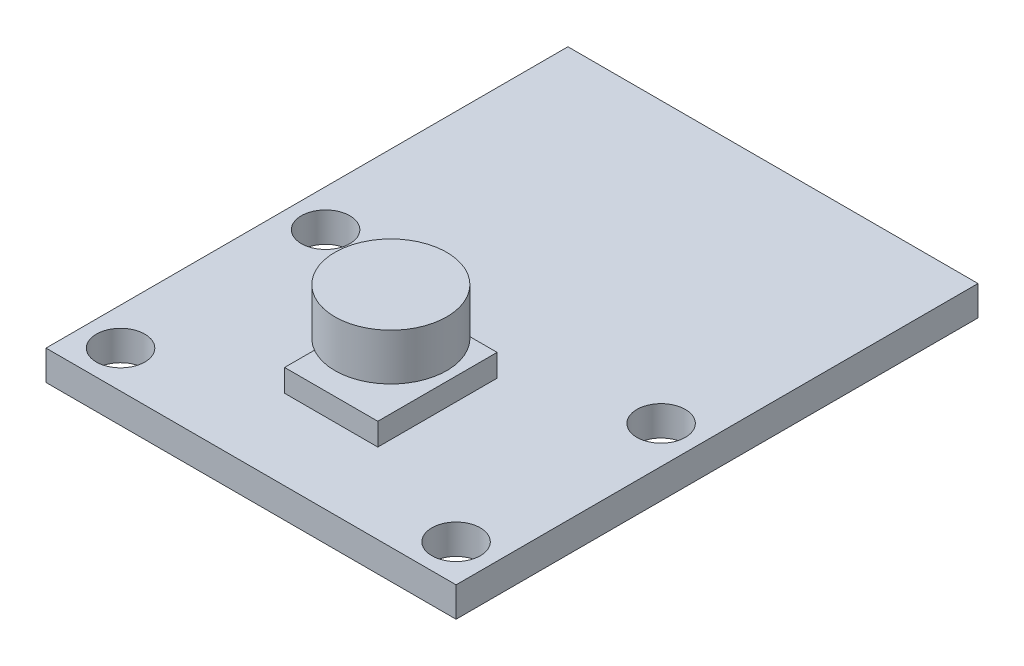
from build123d import *

# Parameters (mm, degrees)
ESQUISSE1_W        = 22
ESQUISSE1_H        = 28
ESQUISSE1_R        = 1.3
BOSS_EXTRU_1_DEPTH = 1.6
ESQUISSE2_W        = 5
ESQUISSE2_H        = 6.4
BOSS_EXTRU_2_DEPTH = 1.2
BOSS_EXTRU_3_START = 1
ESQUISSE3_R        = 3
BOSS_EXTRU_3_DEPTH = 2.5


with BuildPart() as part:
    # Esquisse1 → Boss.-Extru.1 (new body)
    with BuildSketch(Plane(origin=(0, 0, 0), x_dir=(1, 0, 0), z_dir=(0, 1, 0))):
        with Locations((0, 6.5)):
            Rectangle(ESQUISSE1_W, ESQUISSE1_H)
        with Locations(Location((-9, 5.5, 0), (0, 0, 270))):
            Circle(ESQUISSE1_R, mode=Mode.SUBTRACT)
        with Locations(Location((9, 5.5, 0), (0, 0, 270))):
            Circle(ESQUISSE1_R, mode=Mode.SUBTRACT)
        with Locations(Location((9, -5.5, 0), (0, 0, 270))):
            Circle(ESQUISSE1_R, mode=Mode.SUBTRACT)
        with Locations(Location((-9, -5.5, 0), (0, 0, 270))):
            Circle(ESQUISSE1_R, mode=Mode.SUBTRACT)
    extrude(amount=BOSS_EXTRU_1_DEPTH)

    # Esquisse2 → Boss.-Extru.2 (add)
    with BuildSketch(Plane(origin=(0, 1.6, 0), x_dir=(1, 0, 0), z_dir=(0, 1, 0))):
        Rectangle(ESQUISSE2_W, ESQUISSE2_H)
    extrude(amount=BOSS_EXTRU_2_DEPTH)


with BuildPart() as body_2:
    # Esquisse3 → Boss.-Extru.3 (new body)
    with BuildSketch(Plane(origin=(0, 2.8, 0), x_dir=(1, 0, 0), z_dir=(0, 1, 0)).offset(BOSS_EXTRU_3_START)):
        with Locations(Location((0, 0, 0), (0, 0, 270))):
            Circle(ESQUISSE3_R)
    extrude(amount=BOSS_EXTRU_3_DEPTH)


solid = Compound([part.part, body_2.part])
